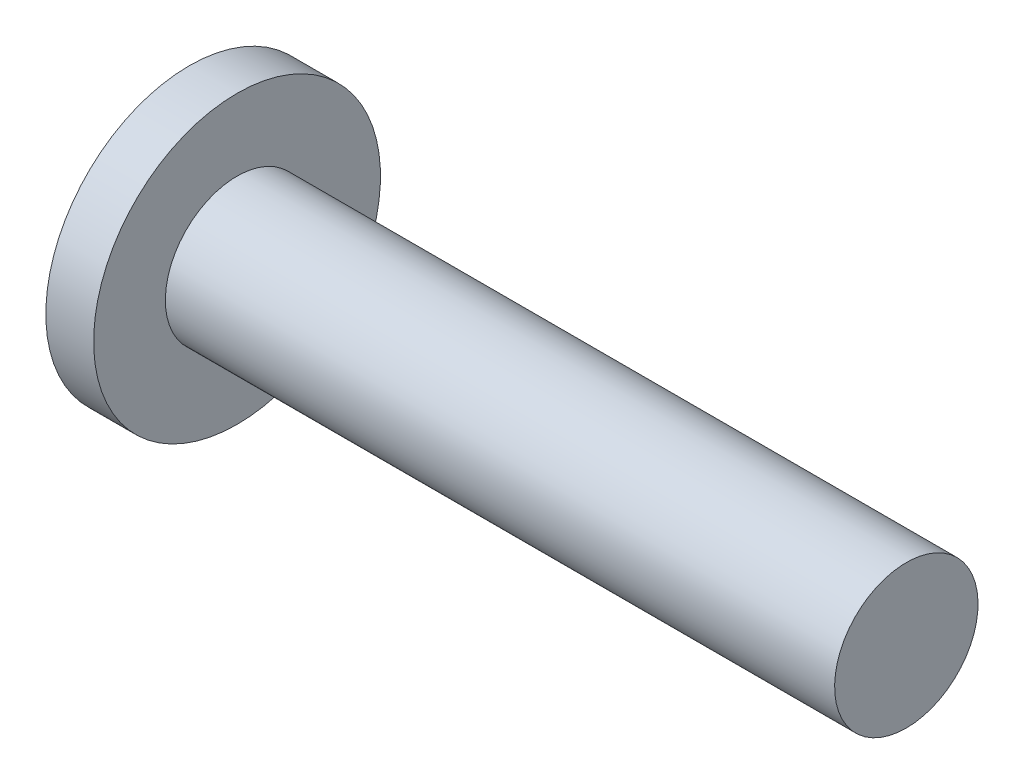
from build123d import *


with BuildPart() as part:
    # 草图1 → 旋转1 (revolve)
    with BuildSketch(Plane.XY, mode=Mode.PRIVATE) as revolve_1_sk:
        Polygon((0, 0), (14, 0), (14, -1.5), (-1, -1.5), (-1, 1.5), (0, 1.5), align=None)
    revolve(revolve_1_sk.sketch.rotate(Axis((-1, -1.5, 0), (1, 0, 0)), 180), axis=Axis((-1, -1.5, 0), (1, 0, 0)))


solid = part.part
